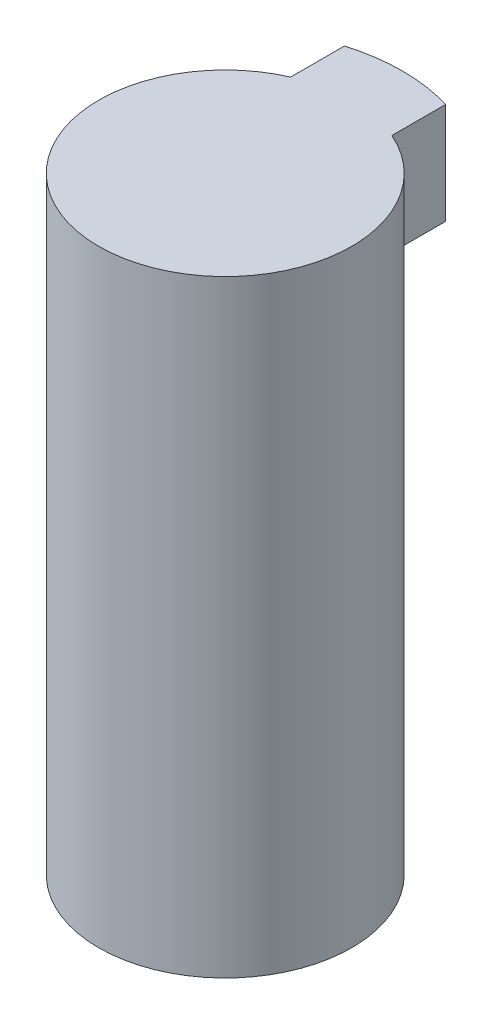
from build123d import *

# Parameters (mm, degrees)
SKETCH1_R           = 3.175
SKETCH1_R_2         = 2.54
BOSS_EXTRUDE1_DEPTH = 12.7
BOSS_EXTRUDE2_DEPTH = 2.54


with BuildPart() as part:
    # Sketch1 → Boss-Extrude1 (new body)
    with BuildSketch(Plane(origin=(0, 0, 0), x_dir=(1, 0, 0), z_dir=(0, 1, 0))):
        with Locations(Location((0, 0, 0), (0, 0, 270))):
            Circle(SKETCH1_R)
        with Locations(Location((0, 0, 0), (0, 0, 270))):
            Circle(SKETCH1_R_2, mode=Mode.SUBTRACT)
    extrude(amount=BOSS_EXTRUDE1_DEPTH)

    # Sketch3 → Boss-Extrude2 (add)
    with BuildSketch(Plane(origin=(0, 12.7, 0), x_dir=(1, 0, 0), z_dir=(0, 1, 0))):
        with BuildLine():
            Line((-1.27, 4.259709497), (-1.27, 2.909935566))
            ThreePointArc((-1.27, 2.909935566), (0, -3.175), (1.27, 2.909935566))
            Line((1.27, 2.909935566), (1.27, 4.259709497))
            ThreePointArc((1.27, 4.259709497), (0, 4.445), (-1.27, 4.259709497))
        make_face()
    extrude(amount=BOSS_EXTRUDE2_DEPTH)


solid = part.part
